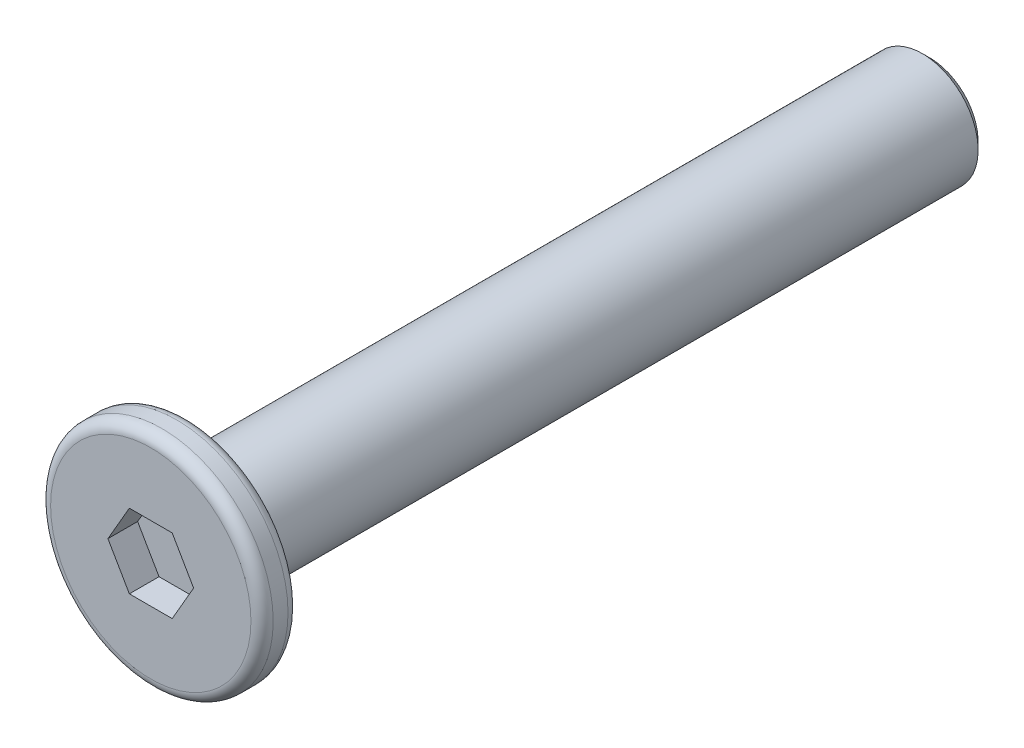
from build123d import *

# Parameters (mm, degrees)
SKETCH_1_R          = 3
EXTRUDE_1_DEPTH     = 0.5
SKETCH_2_R          = 1.5
EXTRUDE_2_DEPTH     = 20
CHAMFER_1_SIZE      = 0.2
CUT_EXTRUDE_1_DEPTH = 0.8
FILLET_2_R          = 0.3


with BuildPart() as part:
    # 草图1 → 凸台-拉伸1 (new, symmetric)
    with BuildSketch(Plane.XY):
        Circle(SKETCH_1_R)
    extrude(amount=EXTRUDE_1_DEPTH, both=True)

    # 草图2 → 凸台-拉伸2 (add)
    with BuildSketch(Plane(origin=(0, 0, -0.5), x_dir=(-1, 0, 0), z_dir=(0, 0, -1))):
        Circle(SKETCH_2_R)
    extrude(amount=EXTRUDE_2_DEPTH)

    # 倒角1
    chamfer_1_edges = [part.edges().sort_by_distance(p)[0] for p in [
        (1.5, 0, -20.5),
    ]]
    chamfer(chamfer_1_edges, length=CHAMFER_1_SIZE)

    # 草图3 → 切除-拉伸1 (cut)
    with BuildSketch(Plane.XY.offset(0.5)):
        Polygon((1.154700538, 0), (0.577350269, 1), (-0.577350269, 1), (-1.154700538, 0), (-0.577350269, -1), (0.577350269, -1), align=None)
    extrude(amount=-CUT_EXTRUDE_1_DEPTH, mode=Mode.SUBTRACT)

    # 圆角2
    fillet_2_edges = [part.edges().sort_by_distance(p)[0] for p in [
        (-3, 0, -0.5),
        (-3, 0, 0.5),
    ]]
    fillet(fillet_2_edges, radius=FILLET_2_R)


solid = part.part
